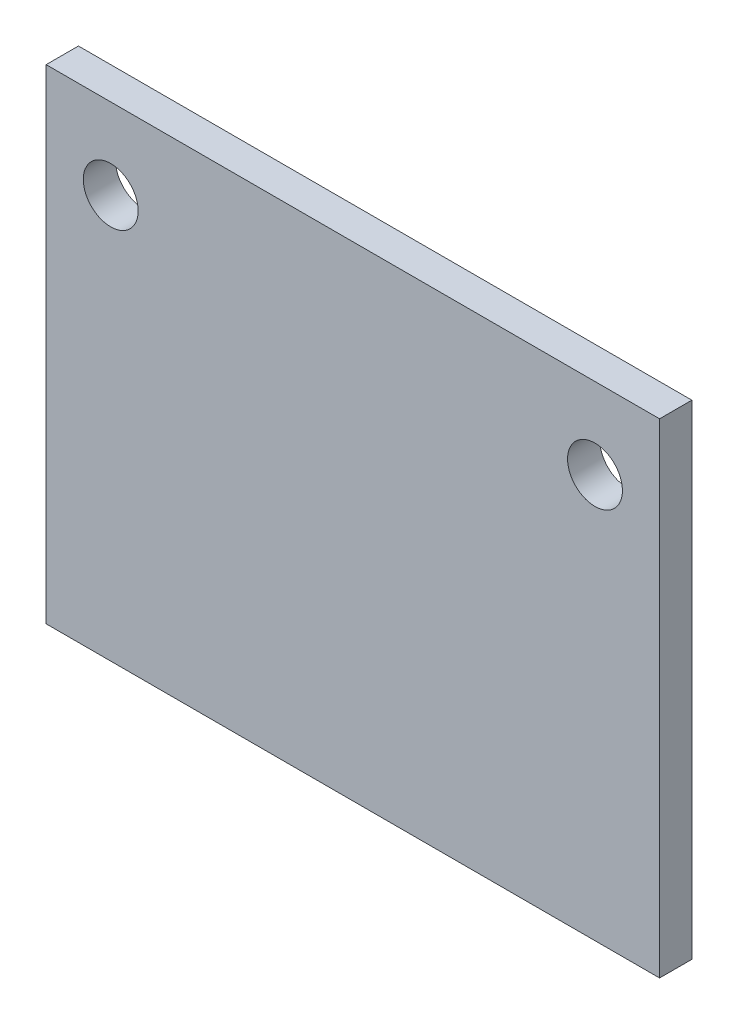
from build123d import *

# Parameters (mm, degrees)
SKETCH1_W           = 38
SKETCH1_H           = 30
SKETCH1_R           = 1.7
BOSS_EXTRUDE1_DEPTH = 2


with BuildPart() as part:
    # Sketch1 → Boss-Extrude1 (new body)
    with BuildSketch(Plane.XY.offset(2)):
        Rectangle(SKETCH1_W, SKETCH1_H)
        with Locations(Location((15, 9.996892342, 0), (0, 0, 180))):
            Circle(SKETCH1_R, mode=Mode.SUBTRACT)
        with Locations(Location((-15, 9.996892342, 0), (0, 0, 180))):
            Circle(SKETCH1_R, mode=Mode.SUBTRACT)
    extrude(amount=-BOSS_EXTRUDE1_DEPTH)


solid = part.part
